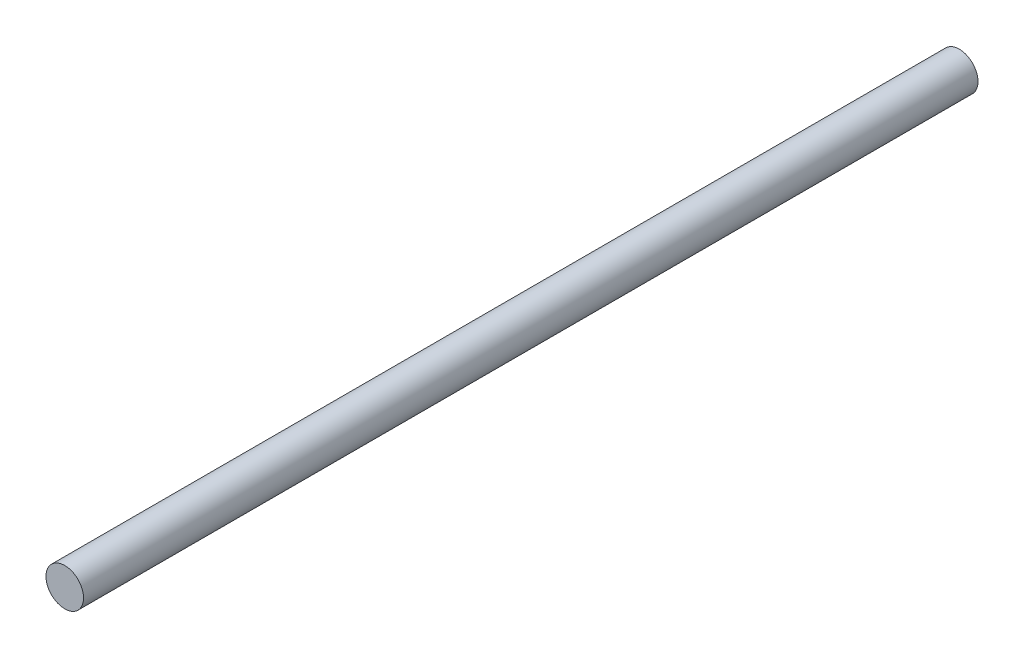
from build123d import *

# Parameters (mm, degrees)
SKETCH1_R           = 1.25
BOSS_EXTRUDE1_DEPTH = 59.5


with BuildPart() as part:
    # Sketch1 → Boss-Extrude1 (new body)
    with BuildSketch(Plane.XY):
        Circle(SKETCH1_R)
    extrude(amount=BOSS_EXTRUDE1_DEPTH)


solid = part.part
